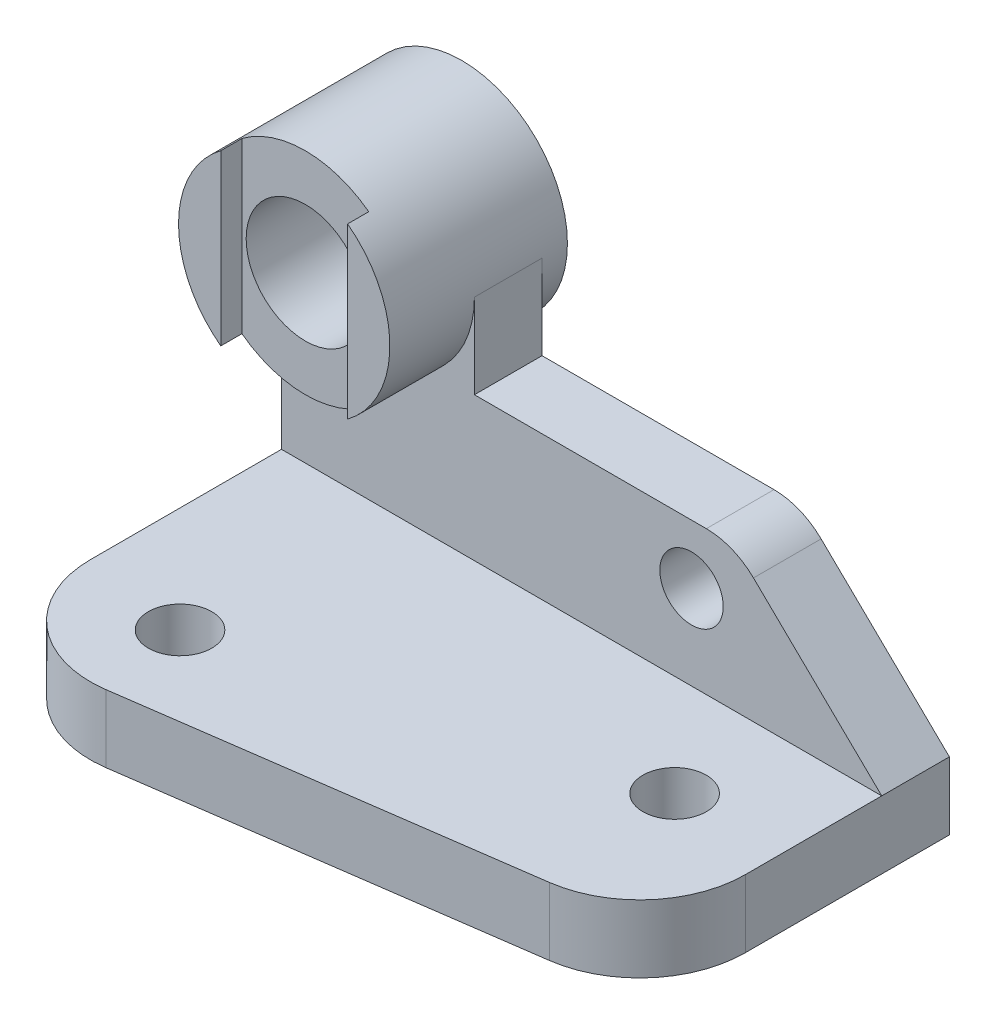
from build123d import *

# Parameters (mm, degrees)
BOSS_EXTRUDE1_DEPTH      = 16
FILLET1_R                = 25
SKETCH2_R                = 7.5
CUT_EXTRUDE1_DEPTH       = 167.901106215
BOSS_EXTRUDE2_DEPTH      = 6
BOSS_EXTRUDE2_DEPTH_BACK = 36
SKETCH3_R                = 25
SKETCH3_R_2              = 14
BOSS_EXTRUDE3_DEPTH      = 16
SKETCH5_R                = 7.5
CUT_EXTRUDE2_DEPTH       = 185.720197269
SKETCH6_W                = 30
SKETCH6_H                = 60
CUT_EXTRUDE3_DEPTH       = 5


with BuildPart() as part:
    # Sketch1 → Boss-Extrude1 (new body)
    with BuildSketch(Plane(origin=(0, 0, 0), x_dir=(1, 0, 0), z_dir=(0, 1, 0))):
        Polygon((0, 0), (142, 0), (142, -70), (0, -90), align=None)
    extrude(amount=BOSS_EXTRUDE1_DEPTH)

    # Fillet1
    fillet1_edges = [part.edges().sort_by_distance(p)[0] for p in [
        (142, 8, 70),
        (0, 8, 90),
    ]]
    fillet(fillet1_edges, radius=FILLET1_R)

    # Sketch2 → Cut-Extrude1 (cut, through all)
    with BuildSketch(Plane(origin=(0, 16, 0), x_dir=(1, 0, 0), z_dir=(0, 1, 0))):
        with Locations(Location((25, -65, 0), (0, 0, 270))):
            Circle(SKETCH2_R)
        with Locations(Location((117, -40, 0), (0, 0, 270))):
            Circle(SKETCH2_R)
    extrude(amount=-CUT_EXTRUDE1_DEPTH, mode=Mode.SUBTRACT)



with BuildPart() as body_2:
    # Sketch3 → Boss-Extrude2 (new, two sides: drawn at the far end of the back side and taken through both)
    with BuildSketch(Plane(origin=(0, 0, 0), x_dir=(-1, 0, 0), z_dir=(0, 0, -1)).offset(-BOSS_EXTRUDE2_DEPTH_BACK)):
        with Locations((-20.64, 70)):
            Circle(SKETCH3_R)
        with Locations((-20.64, 70)):
            Circle(SKETCH3_R_2, mode=Mode.SUBTRACT)
    extrude(amount=BOSS_EXTRUDE2_DEPTH + BOSS_EXTRUDE2_DEPTH_BACK)


with BuildPart() as part_1:
    add(part.part)

    add(body_2.part)  # Boss-Extrude3 merges body 2
    # Sketch4 → Boss-Extrude3 (add)
    with BuildSketch(Plane.XY):
        with BuildLine():
            Line((142, 16), (111.656574903, 45.476470094))
            ThreePointArc((111.656574903, 45.476470094), (106.523670107, 48.826050072), (100.508003955, 50))
            Line((100.508003955, 50), (45.64, 50))
            Line((45.64, 50), (45.64, 70))
            ThreePointArc((45.64, 70), (28.02241153, 46.114858175), (0, 55.893604287))
            Line((0, 55.893604287), (0, 16))
            Line((0, 16), (142, 16))
        make_face()
    extrude(amount=BOSS_EXTRUDE3_DEPTH)

    # Sketch5 → Cut-Extrude2 (cut, through all)
    with BuildSketch(Plane.XY.offset(16)):
        with Locations((97, 36)):
            Circle(SKETCH5_R)
    extrude(amount=-CUT_EXTRUDE2_DEPTH, mode=Mode.SUBTRACT)

    # Sketch6 → Cut-Extrude3 (cut)
    with BuildSketch(Plane.XY.offset(36)):
        with Locations((20.64, 70)):
            Rectangle(SKETCH6_W, SKETCH6_H)
    extrude(amount=-CUT_EXTRUDE3_DEPTH, mode=Mode.SUBTRACT)


solid = part_1.part
